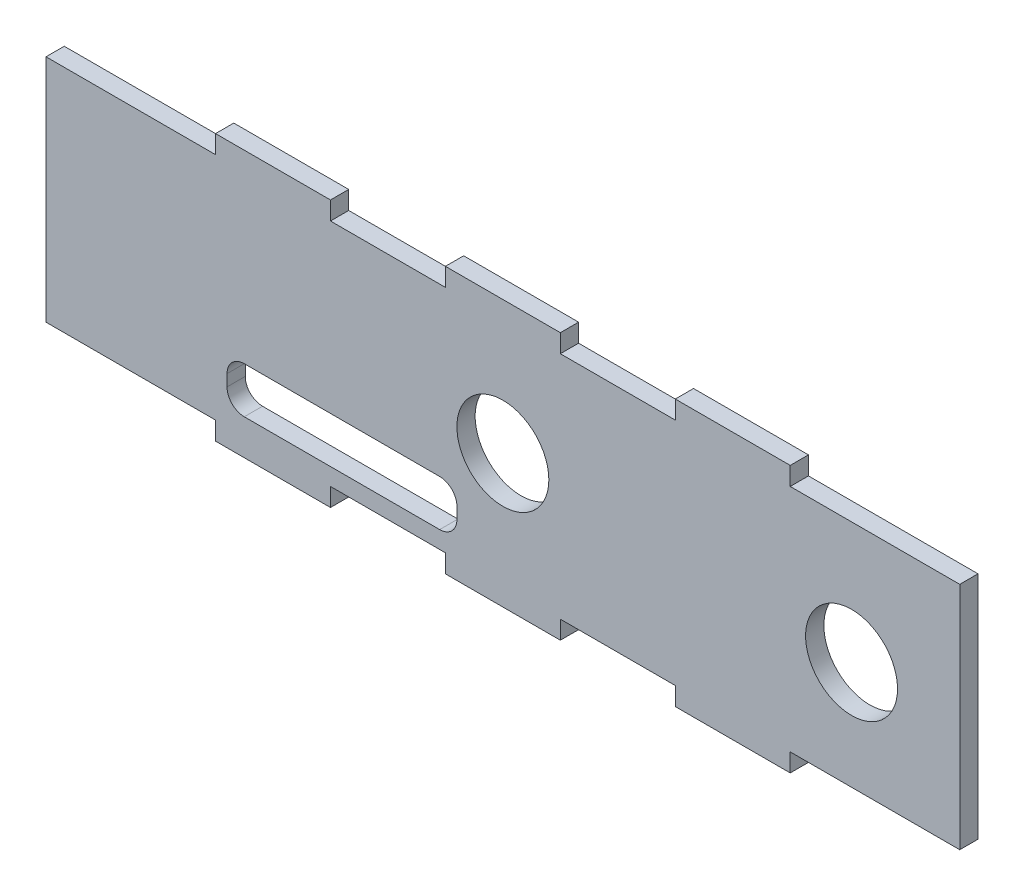
from build123d import *

# Parameters (mm, degrees)
ESQUISSE1_W             = 165.35
ESQUISSE1_H             = 46.35
BOSS_EXTRU_1_DEPTH      = 3.175
ESQUISSE5_W             = 20
ESQUISSE5_H             = 3.175
ESQUISSE5_W_2           = 26.325
ENL_V_MAT_EXTRU_2_DEPTH = 86.920410119
ESQUISSE7_W             = 3.175
ESQUISSE7_H             = 46.35
ENL_V_MAT_EXTRU_4_DEPTH = 86.920410119
ESQUISSE8_W             = 3.175
ESQUISSE8_H             = 3.175
ENL_V_MAT_EXTRU_5_DEPTH = 83.869845239
ESQUISSE6_R             = 8
ENL_V_MAT_EXTRU_3_DEPTH = 83.869845239
ESQUISSE9_W             = 40
ESQUISSE9_H             = 8
ENL_V_MAT_EXTRU_6_DEPTH = 83.869845239
CONG_1_R                = 3


with BuildPart() as part:
    # Esquisse1 → Boss.-Extru.1 (new body)
    with BuildSketch(Plane.XY):
        Rectangle(ESQUISSE1_W, ESQUISSE1_H)
    extrude(amount=BOSS_EXTRU_1_DEPTH)

    # Esquisse5 → Enlèv. mat.-Extru.2 (cut, through all)
    with BuildSketch(Plane.XY.offset(3.175)):
        with Locations((-20, -21.5875)):
            Rectangle(ESQUISSE5_W, ESQUISSE5_H)
        with Locations((20, -21.5875)):
            Rectangle(ESQUISSE5_W, ESQUISSE5_H)
        with Locations((63.1625, -21.5875)):
            Rectangle(ESQUISSE5_W_2, ESQUISSE5_H)
        with Locations((-63.1625, -21.5875)):
            Rectangle(ESQUISSE5_W_2, ESQUISSE5_H)
    enl_v_mat_extru_2 = extrude(amount=-ENL_V_MAT_EXTRU_2_DEPTH, mode=Mode.SUBTRACT)

    # Symétrie2: Enlèv. mat.-Extru.2 across plane
    add(enl_v_mat_extru_2.mirror(Plane.ZX), mode=Mode.SUBTRACT)

    # Esquisse7 → Enlèv. mat.-Extru.4 (cut, through all)
    with BuildSketch(Plane.XY.offset(3.175)):
        with Locations((-81.0875, 0)):
            Rectangle(ESQUISSE7_W, ESQUISSE7_H)
        with Locations((81.0875, 0)):
            Rectangle(ESQUISSE7_W, ESQUISSE7_H)
    extrude(amount=-ENL_V_MAT_EXTRU_4_DEPTH, mode=Mode.SUBTRACT)

    # Esquisse8 → Enlèv. mat.-Extru.5 (cut, through all)
    with BuildSketch(Plane.XY.offset(3.175)):
        with Locations((-77.9125, 21.5875)):
            Rectangle(ESQUISSE8_W, ESQUISSE8_H)
        with Locations((-77.9125, -21.5875)):
            Rectangle(ESQUISSE8_W, ESQUISSE8_H)
        with Locations((77.9125, -21.5875)):
            Rectangle(ESQUISSE8_W, ESQUISSE8_H)
        with Locations((77.9125, 21.5875)):
            Rectangle(ESQUISSE8_W, ESQUISSE8_H)
    extrude(amount=-ENL_V_MAT_EXTRU_5_DEPTH, mode=Mode.SUBTRACT)

    # Esquisse6 → Enlèv. mat.-Extru.3 (cut, through all)
    with BuildSketch(Plane.XY.offset(3.175)):
        Circle(ESQUISSE6_R)
        with Locations((60.675, -1.175)):
            Circle(ESQUISSE6_R)
    extrude(amount=-ENL_V_MAT_EXTRU_3_DEPTH, mode=Mode.SUBTRACT)

    # Esquisse9 → Enlèv. mat.-Extru.6 (cut, through all)
    with BuildSketch(Plane.XY.offset(3.175)):
        with Locations((-28, -13)):
            Rectangle(ESQUISSE9_W, ESQUISSE9_H)
    extrude(amount=-ENL_V_MAT_EXTRU_6_DEPTH, mode=Mode.SUBTRACT)

    # Congé1
    cong_1_edges = [part.edges().sort_by_distance(p)[0] for p in [
        (-48, -17, 1.5875),
        (-48, -9, 1.5875),
        (-8, -9, 1.5875),
        (-8, -17, 1.5875),
    ]]
    fillet(cong_1_edges, radius=CONG_1_R)


solid = part.part
